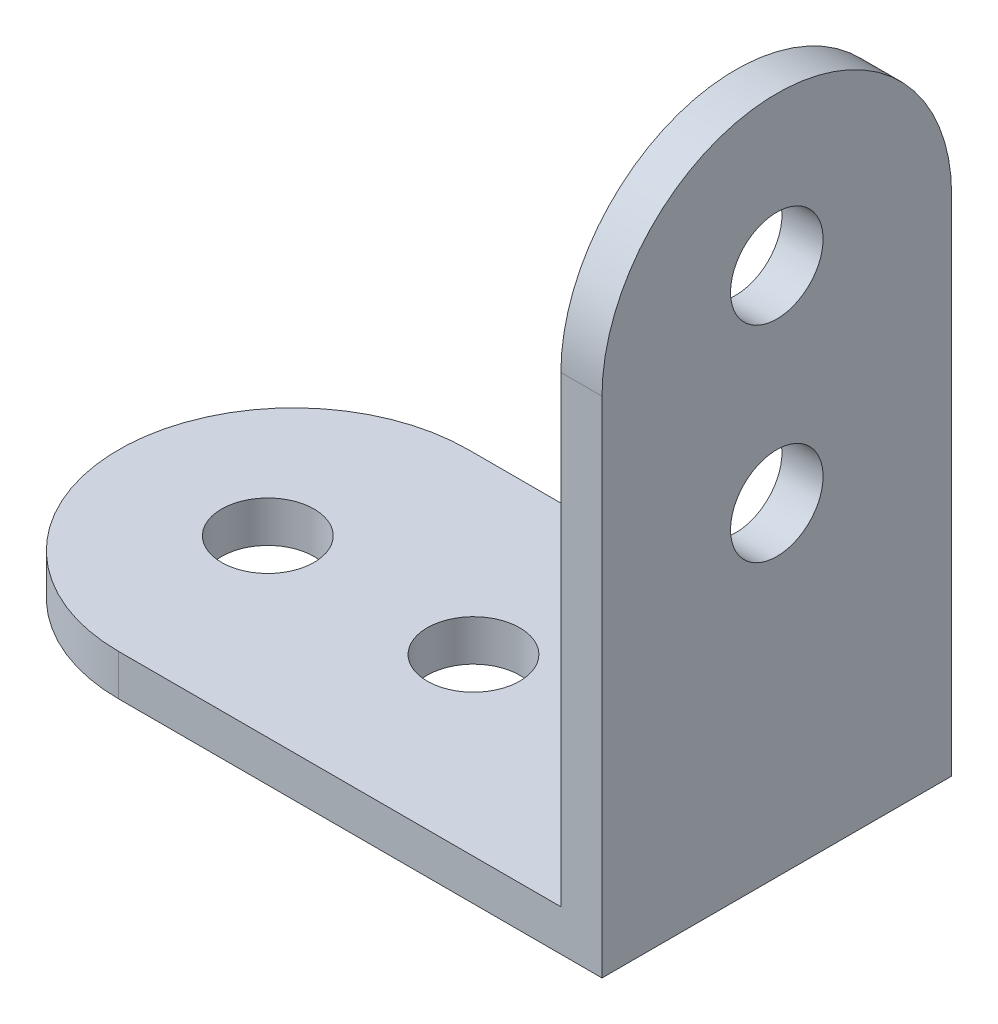
from build123d import *

# Parameters (mm, degrees)
BOSS_EXTRU_1_DEPTH      = 17
ENL_V_MAT_EXTRU_1_DEPTH = 48.728398255
ENL_V_MAT_EXTRU_2_DEPTH = 48.68647607
ESQUISSE4_R             = 2.25
ENL_V_MAT_EXTRU_3_DEPTH = 48.728398255
ESQUISSE5_R             = 2.25
ENL_V_MAT_EXTRU_4_DEPTH = 48.68647607


with BuildPart() as part:
    # Esquisse1 → Boss.-Extru.1 (new body)
    with BuildSketch(Plane.XY):
        Polygon((0, 0), (32, 0), (32, 33), (30, 33), (30, 2), (0, 2), align=None)
    extrude(amount=BOSS_EXTRU_1_DEPTH)

    # Esquisse2 → Enlèv. mat.-Extru.1 (cut, through all)
    with BuildSketch(Plane.ZY.offset(-30)):
        with BuildLine():
            ThreePointArc((8.5, 33), (14.51040764, 30.51040764), (17, 24.5))
            Line((17, 24.5), (17, 33))
            Line((17, 33), (8.5, 33))
        make_face()
        with BuildLine():
            Line((0, 33), (0, 24.5))
            ThreePointArc((0, 24.5), (2.48959236, 30.51040764), (8.5, 33))
            Line((8.5, 33), (0, 33))
        make_face()
    extrude(amount=-ENL_V_MAT_EXTRU_1_DEPTH, mode=Mode.SUBTRACT)

    # Esquisse3 → Enlèv. mat.-Extru.2 (cut, through all)
    with BuildSketch(Plane(origin=(0, 2, 0), x_dir=(1, 0, 0), z_dir=(0, 1, 0))):
        with BuildLine():
            ThreePointArc((8.5, -17), (2.48959236, -14.51040764), (0, -8.5))
            Line((0, -8.5), (0, -17))
            Line((0, -17), (8.5, -17))
        make_face()
        with BuildLine():
            ThreePointArc((0, -8.5), (2.48959236, -2.48959236), (8.5, 0))
            Line((8.5, 0), (0, 0))
            Line((0, 0), (0, -8.5))
        make_face()
    extrude(amount=-ENL_V_MAT_EXTRU_2_DEPTH, mode=Mode.SUBTRACT)

    # Esquisse4 → Enlèv. mat.-Extru.3 (cut, through all)
    with BuildSketch(Plane.ZY.offset(-30)):
        with Locations(Location((8.5, 25.75, 0), (0, 0, 270))):
            Circle(ESQUISSE4_R)
        with Locations(Location((8.5, 15.75, 0), (0, 0, 270))):
            Circle(ESQUISSE4_R)
    extrude(amount=-ENL_V_MAT_EXTRU_3_DEPTH, mode=Mode.SUBTRACT)

    # Esquisse5 → Enlèv. mat.-Extru.4 (cut, through all)
    with BuildSketch(Plane(origin=(0, 2, 0), x_dir=(1, 0, 0), z_dir=(0, 1, 0))):
        with Locations(Location((7.25, -8.5, 0), (0, 0, 180))):
            Circle(ESQUISSE5_R)
        with Locations(Location((17.25, -8.5, 0), (0, 0, 180))):
            Circle(ESQUISSE5_R)
    extrude(amount=-ENL_V_MAT_EXTRU_4_DEPTH, mode=Mode.SUBTRACT)


solid = part.part
